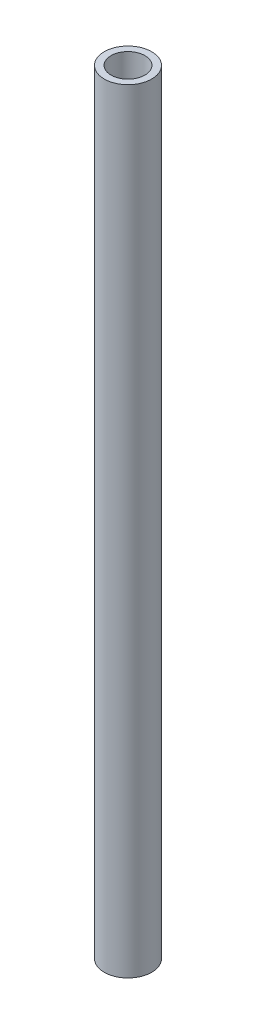
from build123d import *

# Parameters (mm, degrees)
SKETCH1_R           = 7
SKETCH1_R_2         = 4
BOSS_EXTRUDE1_DEPTH = 228.4
SKETCH2_R           = 5
CUT_EXTRUDE1_DEPTH  = 31
CUT_EXTRUDE2_START  = -197.4
SKETCH2_2_R         = 5
CUT_EXTRUDE2_DEPTH  = 31


with BuildPart() as part:
    # Sketch1 → Boss-Extrude1 (new body)
    with BuildSketch(Plane(origin=(0, 0, 0), x_dir=(1, 0, 0), z_dir=(0, 1, 0))):
        with Locations(Location((0, 0, 0), (0, 0, 270))):
            Circle(SKETCH1_R)
        with Locations(Location((0, 0, 0), (0, 0, 270))):
            Circle(SKETCH1_R_2, mode=Mode.SUBTRACT)
    extrude(amount=BOSS_EXTRUDE1_DEPTH)

    # Sketch2 → Cut-Extrude1 (cut)
    with BuildSketch(Plane(origin=(0, 228.4, 0), x_dir=(1, 0, 0), z_dir=(0, 1, 0))):
        with Locations(Location((0, 0, 0), (0, 0, 270))):
            Circle(SKETCH2_R)
    extrude(amount=-CUT_EXTRUDE1_DEPTH, mode=Mode.SUBTRACT)

    # Sketch2<2> → Cut-Extrude2 (cut)
    with BuildSketch(Plane(origin=(0, 228.4, 0), x_dir=(1, 0, 0), z_dir=(0, 1, 0)).offset(CUT_EXTRUDE2_START)):
        with Locations(Location((0, 0, 0), (0, 0, 270))):
            Circle(SKETCH2_2_R)
    extrude(amount=-CUT_EXTRUDE2_DEPTH, mode=Mode.SUBTRACT)


solid = part.part
